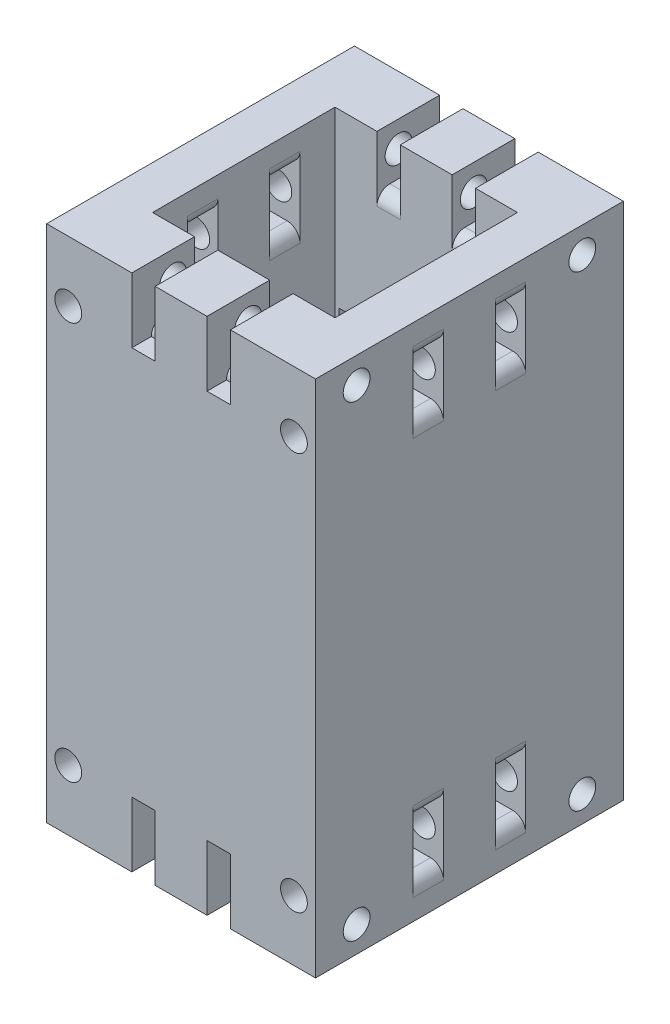
from build123d import *

# Parameters (mm, degrees)
SKETCH_1_W               = 31.1
SKETCH_1_H               = 31.1
SKETCH_1_W_2             = 21.1
SKETCH_1_H_2             = 21.1
EXTRUDE_1_DEPTH          = 60
SKETCH_2_R               = 1.55
CUT_EXTRUDE_1_DEPTH      = 73.445979875
CUT_EXTRUDE_2_DEPTH      = 71.444446197
CUT_EXTRUDE_2_DEPTH_BACK = 71.444446197
SKETCH_3_W               = 2.7
SKETCH_3_H               = 6
SKETCH_4_R               = 1.55
CUT_EXTRUDE_3_DEPTH      = 73.445979875
CUT_EXTRUDE_4_DEPTH      = 71.444446197
CUT_EXTRUDE_4_DEPTH_BACK = 71.444446197
SKETCH_5_W               = 3.5
SKETCH_5_H               = 6.2
FILLET_1_R               = 1.5
SKETCH_6_W               = 20.2
SKETCH_6_H               = 20.2
CUT_EXTRUDE_5_DEPTH      = 73.445979875
SKETCH_7_R               = 1.55
EXTRUDE_2_DEPTH          = 2.25
EXTRUDE_START            = 2.25
SKETCH_8_R               = 1.55
EXTRUDE_3_DEPTH          = 2.25


with BuildPart() as part:
    # 草图1 → 凸台-拉伸1 (new body)
    with BuildSketch(Plane(origin=(0, 0, 0), x_dir=(1, 0, 0), z_dir=(0, 1, 0))):
        with Locations((10.55, 10.55)):
            Rectangle(SKETCH_1_W, SKETCH_1_H)
        with Locations((10.55, 10.55)):
            Rectangle(SKETCH_1_W_2, SKETCH_1_H_2, mode=Mode.SUBTRACT)
    extrude(amount=EXTRUDE_1_DEPTH)

    # 草图2 → 切除-拉伸1 (cut, through all)
    with BuildSketch(Plane.ZY.offset(5)):
        with Locations((-23.6, 57)):
            Circle(SKETCH_2_R)
        with Locations((-23.6, 3)):
            Circle(SKETCH_2_R)
        with Locations((2.5, 3)):
            Circle(SKETCH_2_R)
        with Locations((2.5, 57)):
            Circle(SKETCH_2_R)
    extrude(amount=-CUT_EXTRUDE_1_DEPTH, mode=Mode.SUBTRACT)

    # 草图3 → 切除-拉伸2 (cut, two sides: drawn at the far end of the back side and taken through both)
    with BuildSketch(Plane.XY.offset(-21.1).offset(-CUT_EXTRUDE_2_DEPTH_BACK)):
        with Locations((6.2, 57)):
            Rectangle(SKETCH_3_W, SKETCH_3_H)
        with Locations((14.9, 57)):
            Rectangle(SKETCH_3_W, SKETCH_3_H)
        with Locations((14.9, 3)):
            Rectangle(SKETCH_3_W, SKETCH_3_H)
        with Locations((6.2, 3)):
            Rectangle(SKETCH_3_W, SKETCH_3_H)
    extrude(amount=CUT_EXTRUDE_2_DEPTH + CUT_EXTRUDE_2_DEPTH_BACK, mode=Mode.SUBTRACT)

    # 草图4 → 切除-拉伸3 (cut, through all)
    with BuildSketch(Plane(origin=(0, 0, -26.1), x_dir=(-1, 0, 0), z_dir=(0, 0, -1))):
        with Locations((-23.6, 53)):
            Circle(SKETCH_4_R)
        with Locations((2.5, 53)):
            Circle(SKETCH_4_R)
        with Locations((2.5, 7)):
            Circle(SKETCH_4_R)
        with Locations((-23.6, 7)):
            Circle(SKETCH_4_R)
    extrude(amount=-CUT_EXTRUDE_3_DEPTH, mode=Mode.SUBTRACT)

    # 草图5 → 切除-拉伸4 (cut, two sides: drawn at the far end of the back side and taken through both)
    with BuildSketch(Plane.ZY.offset(-21.1).offset(-CUT_EXTRUDE_4_DEPTH_BACK)):
        with Locations((-15.3, 53)):
            Rectangle(SKETCH_5_W, SKETCH_5_H)
        with Locations((-5.8, 53)):
            Rectangle(SKETCH_5_W, SKETCH_5_H)
        with Locations((-5.8, 7)):
            Rectangle(SKETCH_5_W, SKETCH_5_H)
        with Locations((-15.3, 7)):
            Rectangle(SKETCH_5_W, SKETCH_5_H)
    extrude(amount=CUT_EXTRUDE_4_DEPTH + CUT_EXTRUDE_4_DEPTH_BACK, mode=Mode.SUBTRACT)

    # 圆角1
    fillet_1_edges = [part.edges().sort_by_distance(p)[0] for p in [
        (14.9, 6, 0),
        (14.9, 6, -26.1),
        (14.9, 6, 5),
        (14.9, 54, 0),
        (14.9, 54, -26.1),
        (14.9, 54, 5),
        (6.2, 54, 0),
        (6.2, 54, -26.1),
        (6.2, 54, 5),
        (21.1, 49.9, -15.3),
        (21.1, 56.1, -15.3),
        (21.1, 49.9, -5.8),
        (21.1, 56.1, -5.8),
        (21.1, 10.1, -5.8),
        (21.1, 3.9, -5.8),
        (21.1, 10.1, -15.3),
        (21.1, 3.9, -15.3),
        (0, 3.9, -15.3),
        (0, 10.1, -15.3),
        (26.1, 3.9, -15.3),
        (26.1, 10.1, -15.3),
        (-5, 3.9, -15.3),
        (-5, 10.1, -15.3),
        (0, 3.9, -5.8),
        (0, 10.1, -5.8),
        (26.1, 3.9, -5.8),
        (26.1, 10.1, -5.8),
        (-5, 3.9, -5.8),
        (-5, 10.1, -5.8),
        (0, 56.1, -5.8),
        (0, 49.9, -5.8),
        (26.1, 56.1, -5.8),
        (26.1, 49.9, -5.8),
        (-5, 49.9, -5.8),
        (-5, 56.1, -5.8),
        (0, 56.1, -15.3),
        (0, 49.9, -15.3),
        (26.1, 56.1, -15.3),
        (26.1, 49.9, -15.3),
        (-5, 49.9, -15.3),
        (-5, 56.1, -15.3),
        (6.2, 54, -21.1),
        (14.9, 54, -21.1),
        (14.9, 6, -21.1),
        (6.2, 6, -21.1),
        (6.2, 6, 0),
        (6.2, 6, -26.1),
        (6.2, 6, 5),
    ]]
    fillet(fillet_1_edges, radius=FILLET_1_R)

    # 草图6 → 切除-拉伸5 (cut, through all)
    with BuildSketch(Plane.XY.offset(5)):
        with Locations((10.55, 30)):
            Rectangle(SKETCH_6_W, SKETCH_6_H)
    extrude(amount=-CUT_EXTRUDE_5_DEPTH, mode=Mode.SUBTRACT)

    # 草图7 → 凸台-拉伸2 (add)
    with BuildSketch(Plane.XY.offset(5)):
        Polygon((13.55, 0), (13.55, 7.5), (16.25, 7.5), (16.25, 0), (26.1, 0), (26.1, 60), (16.25, 60), (16.25, 52.5), (13.55, 52.5), (13.55, 60), (7.55, 60), (7.55, 52.5), (4.85, 52.5), (4.85, 60), (-5, 60), (-5, 0), (4.85, 0), (4.85, 7.5), (7.55, 7.5), (7.55, 0), align=None)
        with Locations(Location((23.6, 7, 0), (0, 0, 180))):
            Circle(SKETCH_7_R, mode=Mode.SUBTRACT)
        with Locations(Location((23.6, 53, 0), (0, 0, 180))):
            Circle(SKETCH_7_R, mode=Mode.SUBTRACT)
        with Locations(Location((-2.5, 53, 0), (0, 0, 180))):
            Circle(SKETCH_7_R, mode=Mode.SUBTRACT)
        with Locations(Location((-2.5, 7, 0), (0, 0, 180))):
            Circle(SKETCH_7_R, mode=Mode.SUBTRACT)
    extrude(amount=EXTRUDE_2_DEPTH)

    # 草图8 → 凸台-拉伸3 (add)
    with BuildSketch(Plane(origin=(0, 0, -26.1), x_dir=(-1, 0, 0), z_dir=(0, 0, -1)).offset(EXTRUDE_START)):
        Polygon((-7.55, 7.5), (-4.85, 7.5), (-4.85, 0), (5, 0), (5, 60), (-4.85, 60), (-4.85, 52.5), (-7.55, 52.5), (-7.55, 60), (-13.55, 60), (-13.55, 52.5), (-16.25, 52.5), (-16.25, 60), (-26.1, 60), (-26.1, 0), (-16.25, 0), (-16.25, 7.5), (-13.55, 7.5), (-13.55, 0), (-7.55, 0), align=None)
        with Locations((-23.6, 7)):
            Circle(SKETCH_8_R, mode=Mode.SUBTRACT)
        with Locations((2.5, 7)):
            Circle(SKETCH_8_R, mode=Mode.SUBTRACT)
        with Locations((2.5, 53)):
            Circle(SKETCH_8_R, mode=Mode.SUBTRACT)
        with Locations((-23.6, 53)):
            Circle(SKETCH_8_R, mode=Mode.SUBTRACT)
    extrude(amount=-EXTRUDE_3_DEPTH)


solid = part.part
